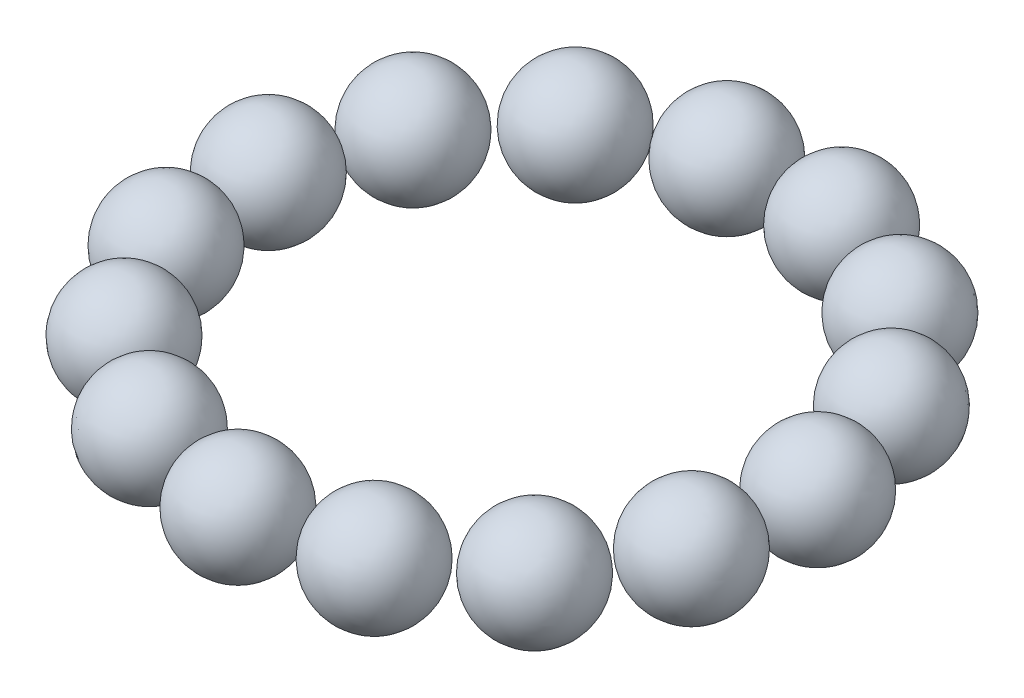
from build123d import *

# Parameters (mm, degrees)
CIRPATTERN2_COUNT = 15


with BuildPart() as part:
    # Sketch2 → Revolve1 (revolve)
    with BuildSketch(Plane.YZ):
        with BuildLine():
            ThreePointArc((-4, 20), (0, 24), (4, 20))
            Line((4, 20), (-4, 20))
        make_face()
    revolve(axis=Axis((0, -4, 20), (0, 1, 0)))


with BuildPart() as cirpattern2_1:
    # CirPattern2: pattern copy
    add(part.part.rotate(Axis((0, 0, 0), (0, 1, 0)), 1 * 360 / CIRPATTERN2_COUNT))


with BuildPart() as cirpattern2_2:
    # CirPattern2: pattern copy
    add(part.part.rotate(Axis((0, 0, 0), (0, 1, 0)), 2 * 360 / CIRPATTERN2_COUNT))


with BuildPart() as cirpattern2_3:
    # CirPattern2: pattern copy
    add(part.part.rotate(Axis((0, 0, 0), (0, 1, 0)), 3 * 360 / CIRPATTERN2_COUNT))


with BuildPart() as cirpattern2_4:
    # CirPattern2: pattern copy
    add(part.part.rotate(Axis((0, 0, 0), (0, 1, 0)), 4 * 360 / CIRPATTERN2_COUNT))


with BuildPart() as cirpattern2_5:
    # CirPattern2: pattern copy
    add(part.part.rotate(Axis((0, 0, 0), (0, 1, 0)), 5 * 360 / CIRPATTERN2_COUNT))


with BuildPart() as cirpattern2_6:
    # CirPattern2: pattern copy
    add(part.part.rotate(Axis((0, 0, 0), (0, 1, 0)), 6 * 360 / CIRPATTERN2_COUNT))


with BuildPart() as cirpattern2_7:
    # CirPattern2: pattern copy
    add(part.part.rotate(Axis((0, 0, 0), (0, 1, 0)), 7 * 360 / CIRPATTERN2_COUNT))


with BuildPart() as cirpattern2_8:
    # CirPattern2: pattern copy
    add(part.part.rotate(Axis((0, 0, 0), (0, 1, 0)), 8 * 360 / CIRPATTERN2_COUNT))


with BuildPart() as cirpattern2_9:
    # CirPattern2: pattern copy
    add(part.part.rotate(Axis((0, 0, 0), (0, 1, 0)), 9 * 360 / CIRPATTERN2_COUNT))


with BuildPart() as cirpattern2_10:
    # CirPattern2: pattern copy
    add(part.part.rotate(Axis((0, 0, 0), (0, 1, 0)), 10 * 360 / CIRPATTERN2_COUNT))


with BuildPart() as cirpattern2_11:
    # CirPattern2: pattern copy
    add(part.part.rotate(Axis((0, 0, 0), (0, 1, 0)), 11 * 360 / CIRPATTERN2_COUNT))


with BuildPart() as cirpattern2_12:
    # CirPattern2: pattern copy
    add(part.part.rotate(Axis((0, 0, 0), (0, 1, 0)), 12 * 360 / CIRPATTERN2_COUNT))


with BuildPart() as cirpattern2_13:
    # CirPattern2: pattern copy
    add(part.part.rotate(Axis((0, 0, 0), (0, 1, 0)), 13 * 360 / CIRPATTERN2_COUNT))


with BuildPart() as cirpattern2_14:
    # CirPattern2: pattern copy
    add(part.part.rotate(Axis((0, 0, 0), (0, 1, 0)), 14 * 360 / CIRPATTERN2_COUNT))


solid = Compound([part.part, cirpattern2_1.part, cirpattern2_2.part, cirpattern2_3.part, cirpattern2_4.part, cirpattern2_5.part, cirpattern2_6.part, cirpattern2_7.part, cirpattern2_8.part, cirpattern2_9.part, cirpattern2_10.part, cirpattern2_11.part, cirpattern2_12.part, cirpattern2_13.part, cirpattern2_14.part])
